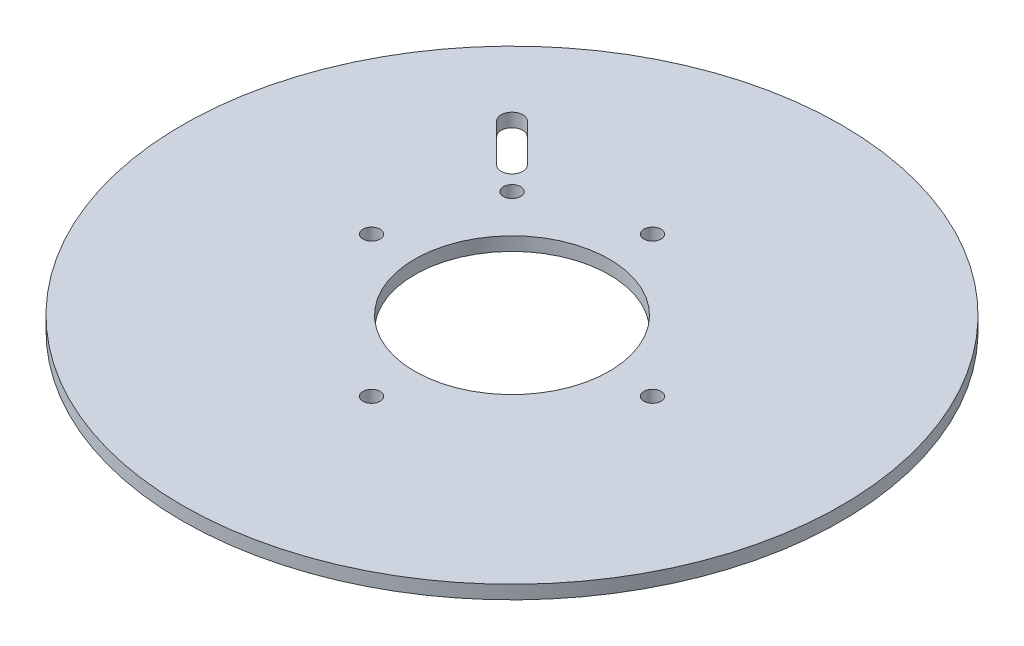
from build123d import *

# Parameters (mm, degrees)
SKETCH1_R           = 77.4600051
BOSS_EXTRUDE1_DEPTH = 3.175
SKETCH20_R          = 22.86
SKETCH20_R_2        = 2.0193
CUT_EXTRUDE10_DEPTH = 250.596695835
CUT_EXTRUDE11_DEPTH = 3.175
SKETCH22_R          = 2.0193
CUT_EXTRUDE12_DEPTH = 250.596695835


with BuildPart() as part:
    # Sketch1 → Boss-Extrude1 (new body)
    with BuildSketch(Plane(origin=(0, 0, 0), x_dir=(1, 0, 0), z_dir=(0, 1, 0))):
        with Locations(Location((0, 0, 0), (0, 0, 270))):
            Circle(SKETCH1_R)
    extrude(amount=BOSS_EXTRUDE1_DEPTH)

    # Sketch20 → Cut-Extrude10 (cut, through all)
    with BuildSketch(Plane(origin=(-73.768816189, 3.175, -121.080352405), x_dir=(1, 0, 0), z_dir=(0, 1, 0))):
        with Locations(Location((73.768816189, -121.080352405, 0), (0, 0, 270))):
            Circle(SKETCH20_R)
        with Locations(Location((73.768816189, -88.060352405, 0), (0, 0, 270))):
            Circle(SKETCH20_R_2)
        with Locations(Location((106.788816189, -121.080352405, 0), (0, 0, 270))):
            Circle(SKETCH20_R_2)
        with Locations(Location((73.768816189, -154.100352405, 0), (0, 0, 270))):
            Circle(SKETCH20_R_2)
        with Locations(Location((40.748816189, -121.080352405, 0), (0, 0, 270))):
            Circle(SKETCH20_R_2)
    extrude(amount=-CUT_EXTRUDE10_DEPTH, mode=Mode.SUBTRACT)

    # Sketch21 → Cut-Extrude11 (cut)
    with BuildSketch(Plane(origin=(-73.768816189, 3.175, -121.080352405), x_dir=(1, 0, 0), z_dir=(0, 1, 0))):
        with BuildLine():
            Line((41.420818538, -92.324457203), (32.440562417, -83.344201082))
            ThreePointArc((32.440562417, -83.344201082), (32.440562417, -79.752098633), (36.032664865, -79.752098633))
            Line((36.032664865, -79.752098633), (45.012920986, -88.732354754))
            ThreePointArc((45.012920986, -88.732354754), (45.012920986, -92.324457203), (41.420818538, -92.324457203))
        make_face()
    extrude(amount=-CUT_EXTRUDE11_DEPTH, mode=Mode.SUBTRACT)

    # Sketch22 → Cut-Extrude12 (cut, through all)
    with BuildSketch(Plane(origin=(-73.768816189, 3.175, -121.080352405), x_dir=(1, 0, 0), z_dir=(0, 1, 0))):
        with Locations(Location((48.605023435, -95.916559651, 0), (0, 0, 270))):
            Circle(SKETCH22_R)
    extrude(amount=-CUT_EXTRUDE12_DEPTH, mode=Mode.SUBTRACT)


solid = part.part
